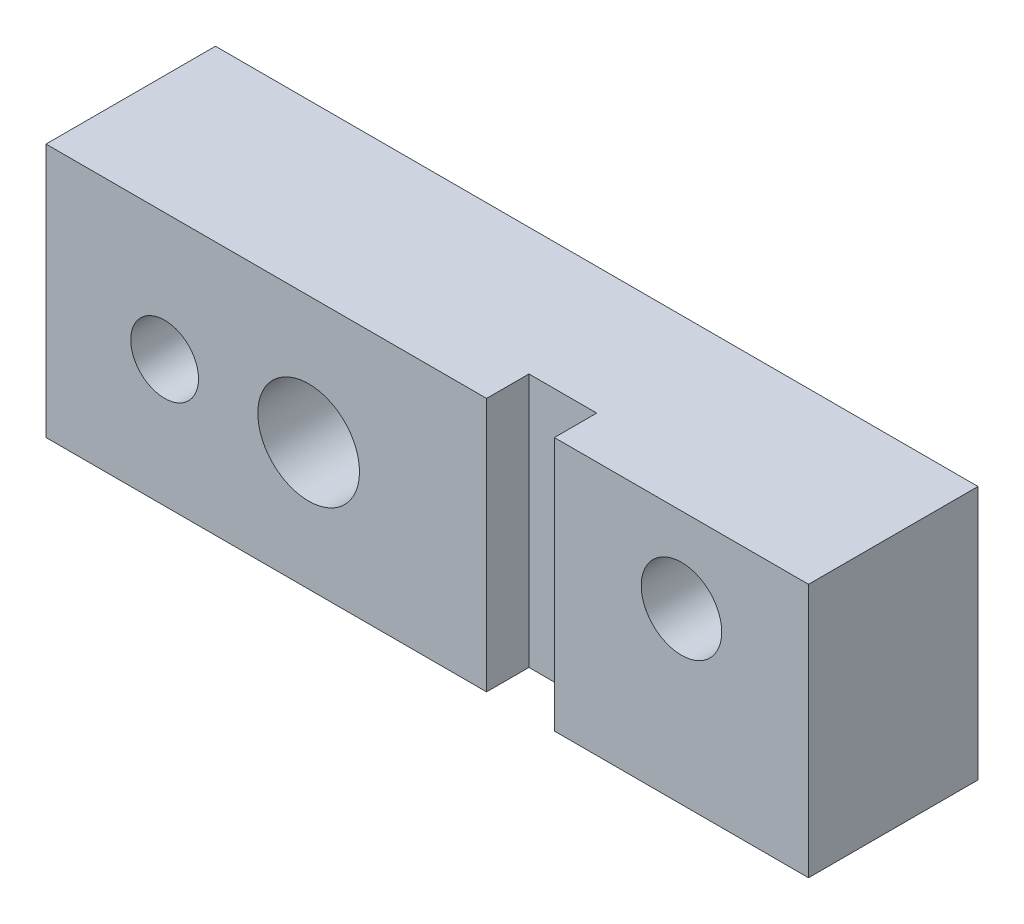
from build123d import *

# Parameters (mm, degrees)
SKETCH_1_W          = 90
SKETCH_1_H          = 30
EXTRUDE_1_DEPTH     = 20
SKETCH_2_W          = 8
SKETCH_2_H          = 30
CUT_EXTRUDE_1_DEPTH = 5
SKETCH_8_R          = 4.75
CUT_EXTRUDE_4_DEPTH = 97.953597148


with BuildPart() as part:
    # Эскиз1 → Бобышка-Вытянуть1 (new body)
    with BuildSketch(Plane.XY):
        with Locations((45, 15)):
            Rectangle(SKETCH_1_W, SKETCH_1_H)
    extrude(amount=-EXTRUDE_1_DEPTH)

    # Эскиз2 → Вырез-Вытянуть1 (cut)
    with BuildSketch(Plane.XY):
        with Locations((56, 15)):
            Rectangle(SKETCH_2_W, SKETCH_2_H)
    extrude(amount=-CUT_EXTRUDE_1_DEPTH, mode=Mode.SUBTRACT)

    # Эскиз8 → Вырез-Вытянуть4 (cut, through all)
    with BuildSketch(Plane.XY):
        with Locations((75, 20)):
            Circle(SKETCH_8_R)
    extrude(amount=-CUT_EXTRUDE_4_DEPTH, mode=Mode.SUBTRACT)

    # Эскиз5 → Вырез-Повернуть1 (revolve, cut)
    with BuildSketch(Plane(origin=(0, 15, 0), x_dir=(1, 0, 0), z_dir=(0, 1, 0))):
        Polygon((31, 0), (37, 0), (37, 12), (34, 12), (34, 20), (31, 20), align=None)
    revolve(axis=Axis((31, 15, 0), (0, 0, -1)), mode=Mode.SUBTRACT)

    # Эскиз6 → Вырез-Повернуть2 (revolve, cut)
    with BuildSketch(Plane(origin=(0, 15, 0), x_dir=(1, 0, 0), z_dir=(0, 1, 0))):
        Polygon((14, 0), (18, 0), (18, 10), (14, 12.309401077), align=None)
    revolve(axis=Axis((14, 15, 0), (0, 0, -1)), mode=Mode.SUBTRACT)


solid = part.part
